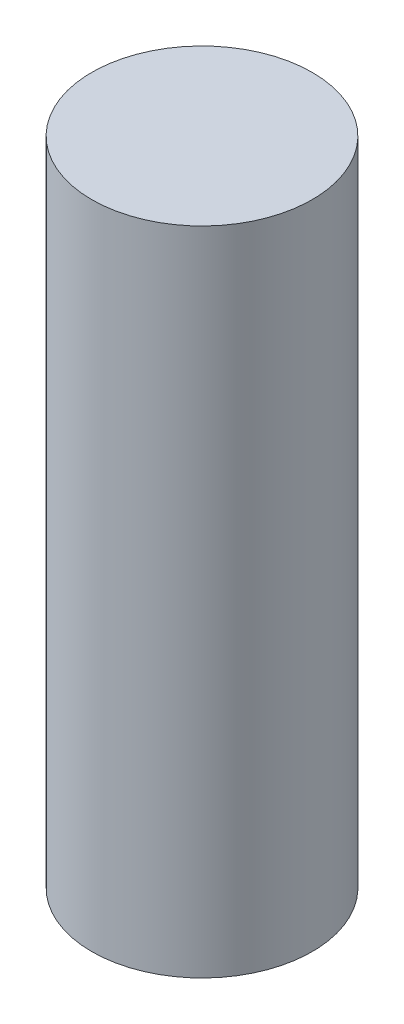
from build123d import *

# Parameters (mm, degrees)
SKETCH1_R           = 11.85
BOSS_EXTRUDE1_DEPTH = 70


with BuildPart() as part:
    # Sketch1 → Boss-Extrude1 (new body)
    with BuildSketch(Plane(origin=(0, 0, 0), x_dir=(1, 0, 0), z_dir=(0, 1, 0))):
        with Locations(Location((0, 0, 0), (0, 0, 270))):
            Circle(SKETCH1_R)
    extrude(amount=BOSS_EXTRUDE1_DEPTH)


solid = part.part
